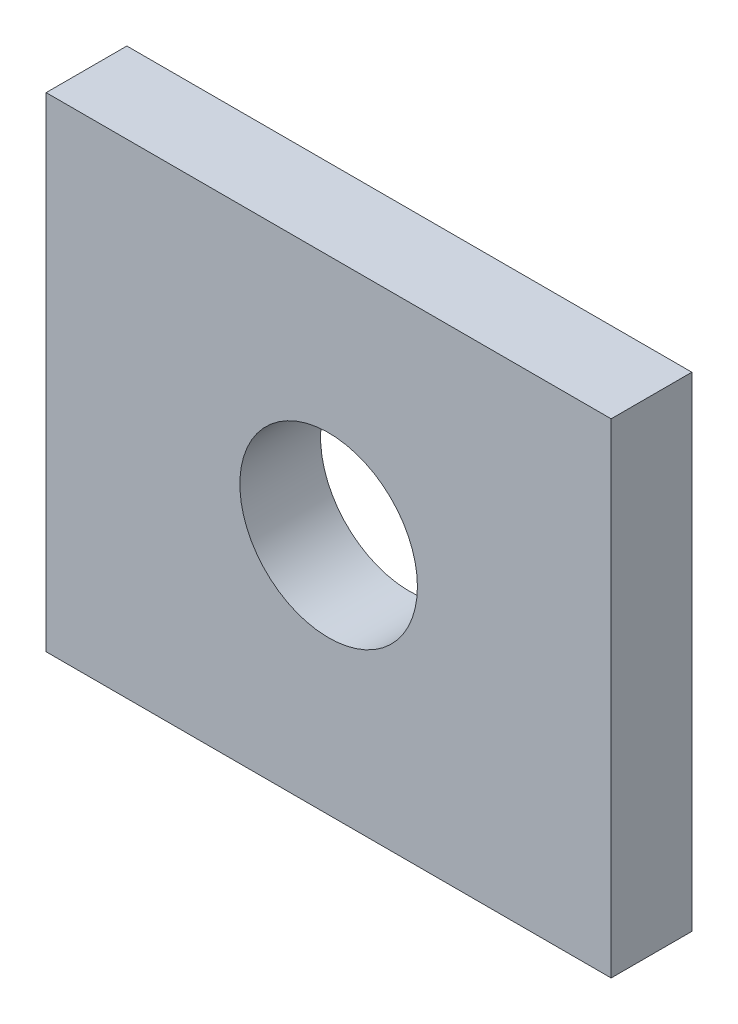
from build123d import *

# Parameters (mm, degrees)
CLAMP_OUTLINE_SKETCH_W = 7
CLAMP_OUTLINE_SKETCH_H = 6
CLAMP_OUTLINE_DEPTH    = 1
M2_CLEARANCE_SKETCH_R  = 1.1
M2_CLEARANCE_DEPTH     = 1.2


with BuildPart() as part:
    # Clamp Outline Sketch → Clamp Outline (new body)
    with BuildSketch(Plane.XY):
        Rectangle(CLAMP_OUTLINE_SKETCH_W, CLAMP_OUTLINE_SKETCH_H)
    extrude(amount=CLAMP_OUTLINE_DEPTH)

    # M2 Clearance Sketch → M2 Clearance (cut)
    with BuildSketch(Plane.XY.offset(-0.1)):
        Circle(M2_CLEARANCE_SKETCH_R)
    extrude(amount=M2_CLEARANCE_DEPTH, mode=Mode.SUBTRACT)


solid = part.part
